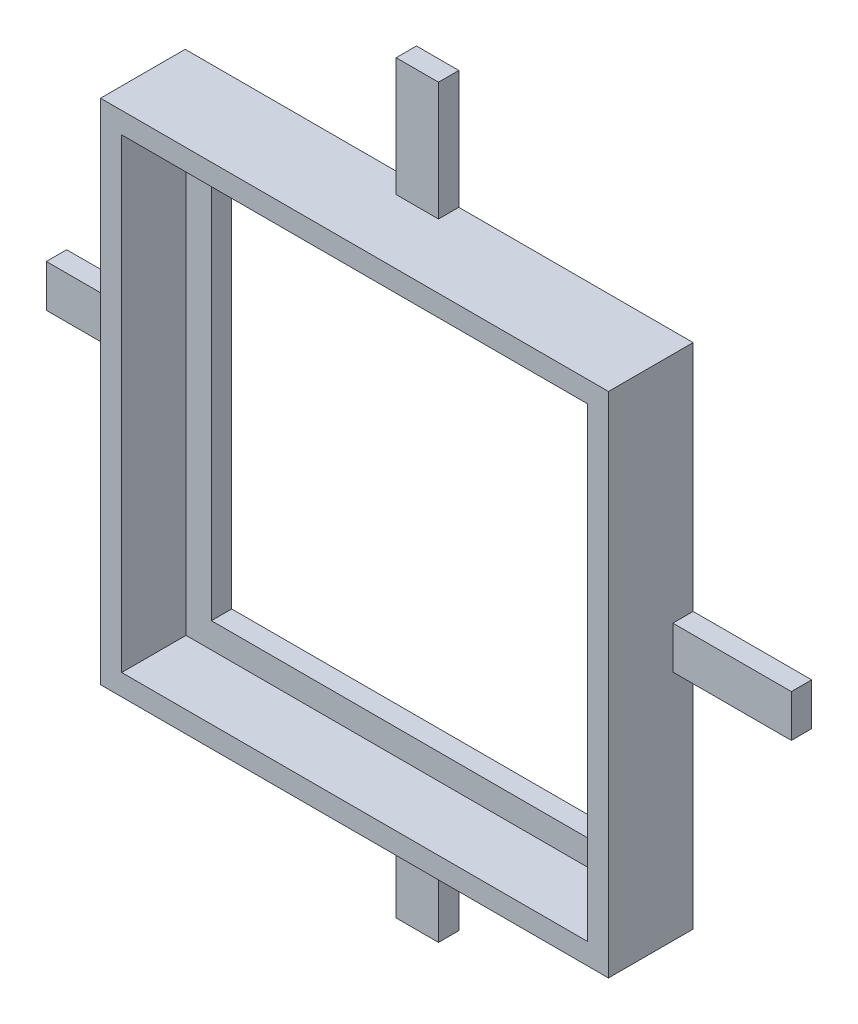
from build123d import *

# Parameters (mm, degrees)
ESQUISSE1_W        = 300
ESQUISSE1_H        = 300
ESQUISSE1_W_2      = 275
ESQUISSE1_H_2      = 275
BOSS_EXTRU_1_DEPTH = 50
ESQUISSE2_W        = 275
ESQUISSE2_H        = 275
ESQUISSE2_W_2      = 245
ESQUISSE2_H_2      = 245
BOSS_EXTRU_2_DEPTH = 12
ESQUISSE3_W        = 25
ESQUISSE3_H        = 70
ESQUISSE3_W_2      = 70
ESQUISSE3_H_2      = 25
BOSS_EXTRU_3_DEPTH = 12


with BuildPart() as part:
    # Esquisse1 → Boss.-Extru.1 (new body)
    with BuildSketch(Plane.XY):
        Rectangle(ESQUISSE1_W, ESQUISSE1_H)
        Rectangle(ESQUISSE1_W_2, ESQUISSE1_H_2, mode=Mode.SUBTRACT)
    extrude(amount=BOSS_EXTRU_1_DEPTH)

    # Esquisse2 → Boss.-Extru.2 (add)
    with BuildSketch(Plane.XY):
        Rectangle(ESQUISSE2_W, ESQUISSE2_H)
        Rectangle(ESQUISSE2_W_2, ESQUISSE2_H_2, mode=Mode.SUBTRACT)
    extrude(amount=BOSS_EXTRU_2_DEPTH)

    # Esquisse3 → Boss.-Extru.3 (add)
    with BuildSketch(Plane.XY):
        with Locations((-0.890165861, 185)):
            Rectangle(ESQUISSE3_W, ESQUISSE3_H)
        with Locations((185, 0)):
            Rectangle(ESQUISSE3_W_2, ESQUISSE3_H_2)
        with Locations((-185, 0)):
            Rectangle(ESQUISSE3_W_2, ESQUISSE3_H_2)
        with Locations((-0.890165861, -185)):
            Rectangle(ESQUISSE3_W, ESQUISSE3_H)
    extrude(amount=BOSS_EXTRU_3_DEPTH)


solid = part.part
